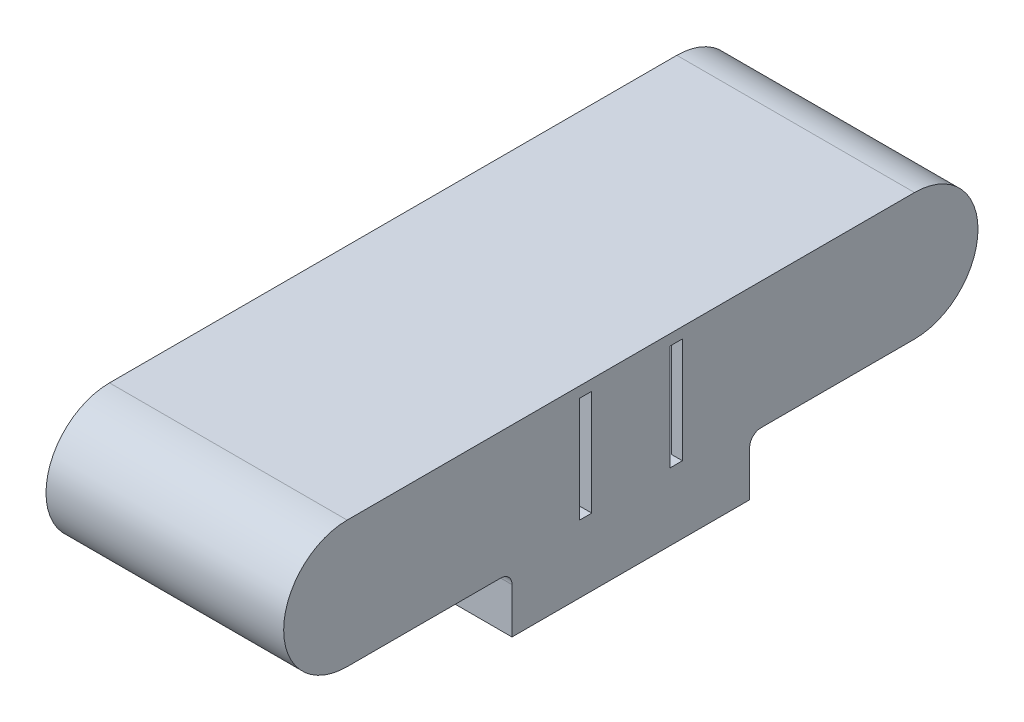
from build123d import *

# Parameters (mm, degrees)
SKETCH1_R           = 11.811
BOSS_EXTRUDE1_DEPTH = 50.8
BOSS_EXTRUDE2_DEPTH = 2.399999772
SKETCH4_W           = 53.199999772
SKETCH4_H           = 53.199999772
BOSS_EXTRUDE4_DEPTH = 12.7
CUT_EXTRUDE2_REACH  = 104.763
SKETCH5_R           = 4.7625
SKETCH7_W           = 53.199999772
SKETCH7_H           = 2.399999772
BOSS_EXTRUDE5_DEPTH = 23.622
CUT_EXTRUDE3_REACH  = 107.024
SKETCH10_W          = 2.794
SKETCH10_H          = 23.622
CUT_EXTRUDE4_DEPTH  = 2.54
FILLET1_R           = 2.54


with BuildPart() as part:
    # Sketch1 → Boss-Extrude1 (new body)
    with BuildSketch(Plane(origin=(0, 0, 0), x_dir=(0, 0, -1), z_dir=(1, 0, 0))):
        with BuildLine():
            Line((-63.5, 14.210999772), (63.5, 14.210999772))
            ThreePointArc((63.5, 14.210999772), (77.710999772, 0), (63.5, -14.210999772))
            Line((63.5, -14.210999772), (-63.5, -14.210999772))
            ThreePointArc((-63.5, -14.210999772), (-77.710999772, 0), (-63.5, 14.210999772))
        make_face()
        with Locations((-63.5, 0)):
            Circle(SKETCH1_R, mode=Mode.SUBTRACT)
        with Locations((63.5, 0)):
            Circle(SKETCH1_R, mode=Mode.SUBTRACT)
        with BuildLine():
            Line((-55.597292014, 11.811), (55.597292014, 11.811))
            ThreePointArc((55.597292014, 11.811), (49.289000228, 0), (55.597292014, -11.811))
            Line((55.597292014, -11.811), (-55.597292014, -11.811))
            ThreePointArc((-55.597292014, -11.811), (-49.289000228, 0), (-55.597292014, 11.811))
        make_face(mode=Mode.SUBTRACT)
    extrude(amount=BOSS_EXTRUDE1_DEPTH)

    # Sketch2 → Boss-Extrude2 (add)
    with BuildSketch(Plane(origin=(50.8, 0, 0), x_dir=(0, 0, -1), z_dir=(1, 0, 0))):
        with BuildLine():
            Line((-63.5, -14.210999772), (63.5, -14.210999772))
            ThreePointArc((63.5, -14.210999772), (77.710999772, 0), (63.5, 14.210999772))
            Line((63.5, 14.210999772), (-63.5, 14.210999772))
            ThreePointArc((-63.5, 14.210999772), (-77.710999772, 0), (-63.5, -14.210999772))
        make_face()
    extrude(amount=BOSS_EXTRUDE2_DEPTH)

    # Sketch4 → Boss-Extrude4 (add)
    with BuildSketch(Plane.XZ.offset(14.210999772)):
        with Locations((26.599999886, 0)):
            Rectangle(SKETCH4_W, SKETCH4_H)
    extrude(amount=BOSS_EXTRUDE4_DEPTH)

    # Sketch5 → Cut-Extrude2 (cut, up to next)
    with BuildSketch(Plane.XZ.offset(26.910999772), mode=Mode.PRIVATE) as cut_extrude2_sk1:
        with Locations(Location((26.599999886, 0, 0), (0, 0, 270))):
            Circle(SKETCH5_R)
    cut_extrude2_tool1 = extrude(cut_extrude2_sk1.sketch, amount=-CUT_EXTRUDE2_REACH, mode=Mode.PRIVATE) & part.part
    add(cut_extrude2_tool1.solids().sort_by_distance((26.6, -26.911, 0))[0], mode=Mode.SUBTRACT)

    # Sketch7 → Boss-Extrude5 (add)
    with BuildSketch(Plane(origin=(0, -11.811, 0), x_dir=(1, 0, 0), z_dir=(0, 1, 0))):
        with Locations((26.599999886, 7.549999886)):
            Rectangle(SKETCH7_W, SKETCH7_H)
        with Locations((26.599999886, -7.549999886)):
            Rectangle(SKETCH7_W, SKETCH7_H)
    extrude(amount=BOSS_EXTRUDE5_DEPTH)

    # Cut-Extrude3: up to this face of the body (flat: up to its plane)
    cut_extrude3_end = Plane(part.part.faces().sort_by_distance((25.4, 0, -8.749999772))[0])
    # Sketch9 → Cut-Extrude3 (cut, up to the picked face)
    with BuildSketch(Plane.XY.offset(8.749999772), mode=Mode.PRIVATE) as cut_extrude3_sk1:
        with BuildLine():
            Line((6.35, 3.175), (44.45, 3.175))
            ThreePointArc((44.45, 3.175), (47.625, 0), (44.45, -3.175))
            Line((44.45, -3.175), (6.35, -3.175))
            ThreePointArc((6.35, -3.175), (3.175, 0), (6.35, 3.175))
        make_face()
    cut_extrude3_tool1 = split(extrude(cut_extrude3_sk1.sketch, amount=-CUT_EXTRUDE3_REACH, mode=Mode.PRIVATE), bisect_by=cut_extrude3_end, keep=Keep.BOTH, mode=Mode.PRIVATE)
    add(cut_extrude3_tool1.solids().sort_by(Axis((25.4, 0, 8.75), (0, 0, -1)))[0], mode=Mode.SUBTRACT)

    # Sketch10 → Cut-Extrude4 (cut)
    with BuildSketch(Plane.ZY.offset(-50.8)):
        with Locations((-10.146999772, 0)):
            Rectangle(SKETCH10_W, SKETCH10_H)
        with Locations((10.146999772, 0)):
            Rectangle(SKETCH10_W, SKETCH10_H)
    extrude(amount=-CUT_EXTRUDE4_DEPTH, mode=Mode.SUBTRACT)

    # Fillet1
    fillet1_edges = [part.edges().sort_by_distance(p)[0] for p in [
        (26.599999886, -14.210999772, 26.599999886),
        (26.599999886, -14.210999772, -26.599999886),
        (50.8, 11.811, 0),
        (50.8, -11.811, 0),
    ]]
    fillet(fillet1_edges, radius=FILLET1_R)


solid = part.part
